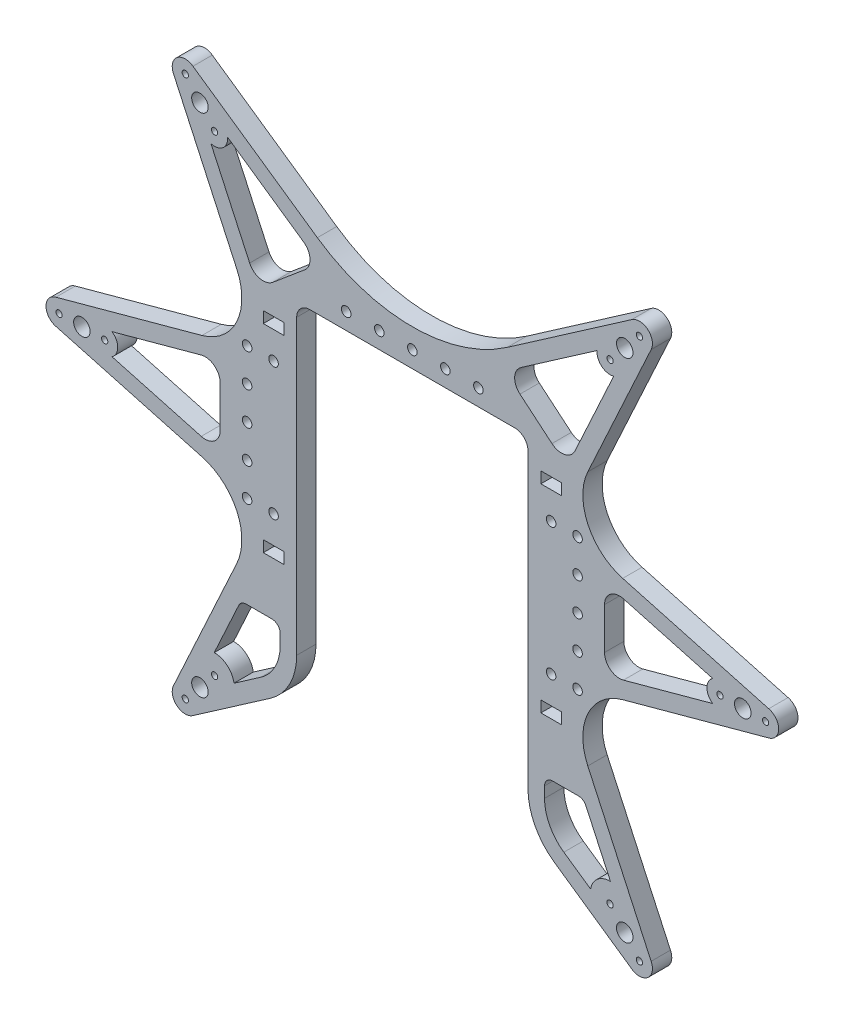
from build123d import *

# Parameters (mm, degrees)
SKETCH1_R           = 0.95
SKETCH1_R_2         = 2.5
SKETCH1_R_3         = 1.449999999
SKETCH1_R_4         = 1.45
SKETCH1_W           = 6.2
SKETCH1_H           = 3.4
BOSS_EXTRUDE1_DEPTH = 5.85
FILLET1_R           = 4


with BuildPart() as part:
    # Sketch1 → Boss-Extrude1 (new body)
    with BuildSketch(Plane.XY):
        with BuildLine():
            Line((576.616706289, 434.650231372), (532.426650002, 446.716128422))
            ThreePointArc((532.426650002, 446.716128422), (529.426650002, 450.550186325), (532.426650002, 454.384244227))
            Line((532.426650002, 454.384244227), (576.616706289, 466.450141278))
            ThreePointArc((576.616706289, 466.450141278), (587.144059076, 475.326320371), (587.176754813, 489.096238418))
            Line((587.176754813, 489.096238418), (568.014947547, 530.703594601))
            ThreePointArc((568.014947547, 530.703594601), (569.023643468, 535.466212845), (573.889065048, 535.63256443))
            Line((573.889065048, 535.63256443), (611.536899087, 509.536826494))
            ThreePointArc((611.536899087, 509.536826494), (640.276650002, 500.550186325), (669.016400917, 509.536826494))
            Line((669.016400917, 509.536826494), (706.664234956, 535.63256443))
            ThreePointArc((706.664234956, 535.63256443), (711.529656536, 535.466212845), (712.538352458, 530.703594601))
            Line((712.538352458, 530.703594601), (693.376545192, 489.096238418))
            ThreePointArc((693.376545192, 489.096238418), (693.409240928, 475.326320371), (703.936593716, 466.450141278))
            Line((703.936593716, 466.450141278), (748.126650002, 454.384244227))
            ThreePointArc((748.126650002, 454.384244227), (751.126650002, 450.550186325), (748.126650002, 446.716128422))
            Line((748.126650002, 446.716128422), (703.936593716, 434.650231372))
            ThreePointArc((703.936593716, 434.650231372), (693.409240928, 425.774052279), (693.376545192, 412.004134232))
            Line((693.376545192, 412.004134232), (712.538352458, 370.396778049))
            ThreePointArc((712.538352458, 370.396778049), (711.529656536, 365.634159805), (706.664234956, 365.46780822))
            Line((706.664234956, 365.46780822), (683.276650002, 381.679000803))
            ThreePointArc((683.276650002, 381.679000803), (677.397639803, 388.334757147), (675.276650002, 396.958170375))
            Line((675.276650002, 396.958170375), (675.276650002, 489.550186325))
            Line((675.276650002, 489.550186325), (605.276650002, 489.550186325))
            Line((605.276650002, 489.550186325), (605.276650002, 396.958170375))
            ThreePointArc((605.276650002, 396.958170375), (603.155660202, 388.334757147), (597.276650002, 381.679000803))
            Line((597.276650002, 381.679000803), (573.889065048, 365.46780822))
            ThreePointArc((573.889065048, 365.46780822), (569.023643468, 365.634159805), (568.014947547, 370.396778049))
            Line((568.014947547, 370.396778049), (587.176754813, 412.004134232))
            ThreePointArc((587.176754813, 412.004134232), (587.144059076, 425.774052279), (576.616706289, 434.650231372))
        make_face()
        with Locations((533.376650002, 450.550186325)):
            Circle(SKETCH1_R, mode=Mode.SUBTRACT)
        with Locations((575.997889034, 527.154630637)):
            Circle(SKETCH1_R_2, mode=Mode.SUBTRACT)
        with Locations((547.176650002, 450.550186325)):
            Circle(SKETCH1_R, mode=Mode.SUBTRACT)
        with Locations((540.276650002, 450.550186325)):
            Circle(SKETCH1_R_2, mode=Mode.SUBTRACT)
        with Locations((590.276650002, 460.550186325)):
            Circle(SKETCH1_R_3, mode=Mode.SUBTRACT)
        with Locations((571.562654527, 532.440337294)):
            Circle(SKETCH1_R, mode=Mode.SUBTRACT)
        with Locations((580.43312354, 521.868923979)):
            Circle(SKETCH1_R, mode=Mode.SUBTRACT)
        with Locations(Location((682.276650002, 470.550186325, 0), (0, 0, 180))):
            Circle(SKETCH1_R_4, mode=Mode.SUBTRACT)
        with Locations((630.276650002, 494.550186325)):
            Circle(SKETCH1_R_4, mode=Mode.SUBTRACT)
        with Locations((620.276650002, 494.550186325)):
            Circle(SKETCH1_R_4, mode=Mode.SUBTRACT)
        with Locations((580.43312354, 379.231448671)):
            Circle(SKETCH1_R, mode=Mode.SUBTRACT)
        with Locations((575.997889034, 373.945742013)):
            Circle(SKETCH1_R_2, mode=Mode.SUBTRACT)
        with Locations((571.562654527, 368.660035356)):
            Circle(SKETCH1_R, mode=Mode.SUBTRACT)
        with Locations(Location((590.276650002, 430.550186325, 0), (0, 0, 180))):
            Circle(SKETCH1_R_3, mode=Mode.SUBTRACT)
        with Locations(Location((590.276650002, 440.550186325, 0), (0, 0, 180))):
            Circle(SKETCH1_R_3, mode=Mode.SUBTRACT)
        with Locations((590.276650002, 470.550186325)):
            Circle(SKETCH1_R_3, mode=Mode.SUBTRACT)
        with Locations(Location((682.276650002, 430.550186325, 0), (0, 0, 180))):
            Circle(SKETCH1_R_4, mode=Mode.SUBTRACT)
        with Locations(Location((708.990645478, 368.660035356, 0), (0, 0, 180))):
            Circle(SKETCH1_R, mode=Mode.SUBTRACT)
        with Locations(Location((704.555410971, 373.945742013, 0), (0, 0, 180))):
            Circle(SKETCH1_R_2, mode=Mode.SUBTRACT)
        with Locations(Location((700.120176464, 379.231448671, 0), (0, 0, 180))):
            Circle(SKETCH1_R, mode=Mode.SUBTRACT)
        with Locations(Location((660.276650002, 494.550186325, 0), (0, 0, 180))):
            Circle(SKETCH1_R_4, mode=Mode.SUBTRACT)
        with Locations(Location((650.276650002, 494.550186325, 0), (0, 0, 180))):
            Circle(SKETCH1_R_4, mode=Mode.SUBTRACT)
        with Locations(Location((700.120176464, 521.868923979, 0), (0, 0, 180))):
            Circle(SKETCH1_R, mode=Mode.SUBTRACT)
        with Locations(Location((708.990645478, 532.440337294, 0), (0, 0, 180))):
            Circle(SKETCH1_R, mode=Mode.SUBTRACT)
        with Locations(Location((690.276650002, 450.550186325, 0), (0, 0, 180))):
            Circle(SKETCH1_R_3, mode=Mode.SUBTRACT)
        with Locations(Location((740.276650002, 450.550186325, 0), (0, 0, 180))):
            Circle(SKETCH1_R_2, mode=Mode.SUBTRACT)
        with Locations(Location((733.376650002, 450.550186325, 0), (0, 0, 180))):
            Circle(SKETCH1_R, mode=Mode.SUBTRACT)
        with Locations(Location((704.555410971, 527.154630637, 0), (0, 0, 180))):
            Circle(SKETCH1_R_2, mode=Mode.SUBTRACT)
        with Locations(Location((747.176650002, 450.550186325, 0), (0, 0, 180))):
            Circle(SKETCH1_R, mode=Mode.SUBTRACT)
        with Locations(Location((690.276650002, 470.550186325, 0), (0, 0, 180))):
            Circle(SKETCH1_R_3, mode=Mode.SUBTRACT)
        with Locations((640.276650002, 494.550186325)):
            Circle(SKETCH1_R_4, mode=Mode.SUBTRACT)
        with Locations((690.276650002, 440.550186325)):
            Circle(SKETCH1_R_3, mode=Mode.SUBTRACT)
        with Locations((690.276650002, 430.550186325)):
            Circle(SKETCH1_R_3, mode=Mode.SUBTRACT)
        with Locations(Location((690.276650002, 460.550186325, 0), (0, 0, 180))):
            Circle(SKETCH1_R_3, mode=Mode.SUBTRACT)
        with Locations((590.276650002, 450.550186325)):
            Circle(SKETCH1_R_3, mode=Mode.SUBTRACT)
        with Locations((598.276650002, 430.550186325)):
            Circle(SKETCH1_R_4, mode=Mode.SUBTRACT)
        with Locations((598.276650002, 470.550186325)):
            Circle(SKETCH1_R_4, mode=Mode.SUBTRACT)
        with BuildLine():
            Line((549.378217697, 453.82975942), (576.389421361, 461.205047663))
            ThreePointArc((576.389421361, 461.205047663), (580.337323048, 460.434368256), (582.12067631, 456.828882764))
            Line((582.12067631, 456.828882764), (582.12067631, 444.271489885))
            ThreePointArc((582.12067631, 444.271489885), (580.337323048, 440.666004394), (576.389421361, 439.895324987))
            Line((576.389421361, 439.895324987), (549.378217697, 447.27061323))
            ThreePointArc((549.378217697, 447.27061323), (551.126650002, 450.550186325), (549.378217697, 453.82975942))
        make_face(mode=Mode.SUBTRACT)
        with BuildLine():
            Line((590.015887334, 402.739634304), (597.776650002, 402.739634304))
            ThreePointArc((597.776650002, 402.739634304), (599.544416955, 402.007401257), (600.276650002, 400.239634304))
            Line((600.276650002, 400.239634304), (600.276650002, 396.958170375))
            ThreePointArc((600.276650002, 396.958170375), (598.726100476, 390.65402441), (594.428250258, 385.788333948))
            Line((594.428250258, 385.788333948), (586.310038369, 380.161164806))
            ThreePointArc((586.310038369, 380.161164806), (584.257709818, 383.789413107), (580.328199648, 385.180523471))
            Line((580.328199648, 385.180523471), (587.745126051, 401.285408274))
            ThreePointArc((587.745126051, 401.285408274), (588.667635675, 402.34491753), (590.015887334, 402.739634304))
        make_face(mode=Mode.SUBTRACT)
        with Locations((598.276650002, 420.515790438)):
            Rectangle(SKETCH1_W, SKETCH1_H, mode=Mode.SUBTRACT)
        with BuildLine():
            Line((694.243261635, 380.161164806), (686.125049746, 385.788333948))
            ThreePointArc((686.125049746, 385.788333948), (681.827199528, 390.65402441), (680.276650002, 396.958170375))
            Line((680.276650002, 396.958170375), (680.276650002, 400.239634304))
            ThreePointArc((680.276650002, 400.239634304), (681.008883049, 402.007401257), (682.776650002, 402.739634304))
            Line((682.776650002, 402.739634304), (690.53741267, 402.739634304))
            ThreePointArc((690.53741267, 402.739634304), (691.88566433, 402.34491753), (692.808173953, 401.285408274))
            Line((692.808173953, 401.285408274), (700.225100356, 385.180523471))
            ThreePointArc((700.225100356, 385.180523471), (696.295590186, 383.789413107), (694.243261635, 380.161164806))
        make_face(mode=Mode.SUBTRACT)
        with BuildLine():
            Line((579.335965232, 518.07435633), (591.048633694, 492.641829961))
            ThreePointArc((591.048633694, 492.641829961), (594.150648115, 490.133983107), (598.026414137, 491.077501553))
            Line((598.026414137, 491.077501553), (607.701712221, 499.196040607))
            ThreePointArc((607.701712221, 499.196040607), (609.303916208, 502.849084775), (607.372828334, 506.339455663))
            Line((607.372828334, 506.339455663), (584.360562722, 522.29049423))
            ThreePointArc((584.360562722, 522.29049423), (582.972134599, 518.843048429), (579.335965232, 518.07435633))
        make_face(mode=Mode.SUBTRACT)
        with Locations((682.276650002, 480.550186325)):
            Rectangle(SKETCH1_W, SKETCH1_H, mode=Mode.SUBTRACT)
        with BuildLine():
            Line((672.851587783, 499.196040607), (682.526885868, 491.077501553))
            ThreePointArc((682.526885868, 491.077501553), (686.402651889, 490.133983107), (689.50466631, 492.641829961))
            Line((689.50466631, 492.641829961), (701.217334773, 518.07435633))
            ThreePointArc((701.217334773, 518.07435633), (697.581165406, 518.843048429), (696.192737283, 522.29049423))
            Line((696.192737283, 522.29049423), (673.18047167, 506.339455663))
            ThreePointArc((673.18047167, 506.339455663), (671.249383797, 502.849084775), (672.851587783, 499.196040607))
        make_face(mode=Mode.SUBTRACT)
        with BuildLine():
            Line((698.432623695, 456.828882764), (698.432623695, 444.271489885))
            ThreePointArc((698.432623695, 444.271489885), (700.215976956, 440.666004394), (704.163878644, 439.895324987))
            Line((704.163878644, 439.895324987), (731.175082307, 447.27061323))
            ThreePointArc((731.175082307, 447.27061323), (729.426650002, 450.550186325), (731.175082307, 453.82975942))
            Line((731.175082307, 453.82975942), (704.163878644, 461.205047663))
            ThreePointArc((704.163878644, 461.205047663), (700.215976956, 460.434368256), (698.432623695, 456.828882764))
        make_face(mode=Mode.SUBTRACT)
        with Locations((682.276650002, 420.515790438)):
            Rectangle(SKETCH1_W, SKETCH1_H, mode=Mode.SUBTRACT)
        with Locations((598.276650002, 480.550186325)):
            Rectangle(SKETCH1_W, SKETCH1_H, mode=Mode.SUBTRACT)
    extrude(amount=BOSS_EXTRUDE1_DEPTH)

    # Fillet1
    fillet1_edges = [part.edges().sort_by_distance(p)[0] for p in [
        (675.276650002, 489.550186325, 2.925),
        (605.276650002, 489.550186325, 2.925),
    ]]
    fillet(fillet1_edges, radius=FILLET1_R)


solid = part.part
